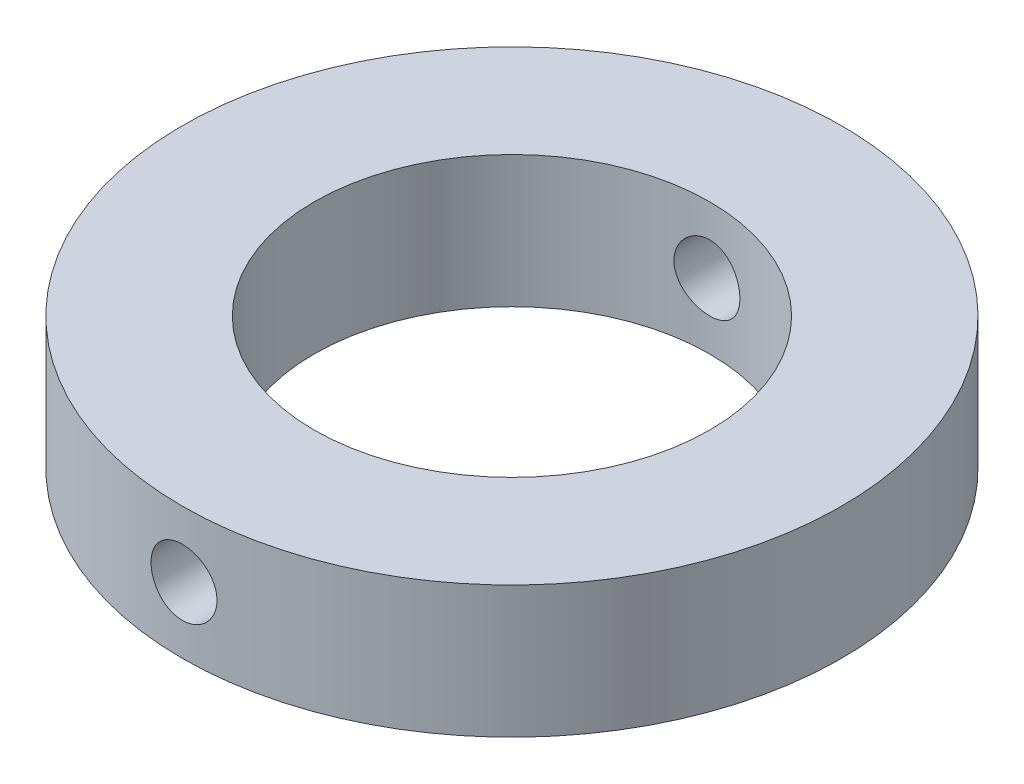
from build123d import *

# Parameters (mm, degrees)
SKETCH1_R           = 25
SKETCH1_R_2         = 15
BOSS_EXTRUDE1_DEPTH = 10
SKETCH2_R           = 2.5
CUT_EXTRUDE1_DEPTH  = 50


with BuildPart() as part:
    # Sketch1 → Boss-Extrude1 (new body)
    with BuildSketch(Plane(origin=(0, 0, 0), x_dir=(1, 0, 0), z_dir=(0, 1, 0))):
        with Locations(Location((0, 0, 0), (0, 0, 270))):
            Circle(SKETCH1_R)
        with Locations(Location((0, 0, 0), (0, 0, 270))):
            Circle(SKETCH1_R_2, mode=Mode.SUBTRACT)
    extrude(amount=BOSS_EXTRUDE1_DEPTH)

    # Sketch2 → Cut-Extrude1 (cut, symmetric)
    with BuildSketch(Plane.XY):
        with Locations((0, 5)):
            Circle(SKETCH2_R)
    extrude(amount=CUT_EXTRUDE1_DEPTH, both=True, mode=Mode.SUBTRACT)


solid = part.part
